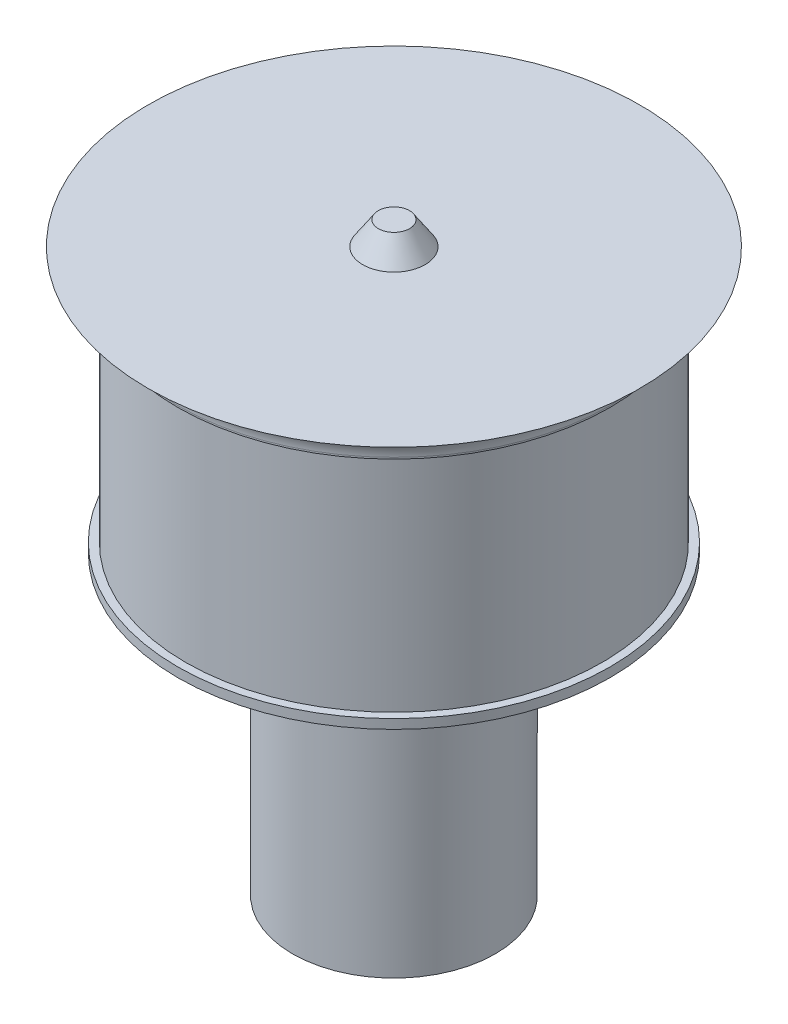
from build123d import *

# Parameters (mm, degrees)
SKETCH_1_R      = 26.7
EXTRUDE_1_DEPTH = 28.8
SKETCH_4_R      = 13
EXTRUDE_2_DEPTH = 39
CHAMFER_1_SIZE  = 1
CHAMFER_1_SIZE2 = 1.5


with BuildPart() as part:
    # 草图1 → 凸台-拉伸1 (new body)
    with BuildSketch(Plane(origin=(0, 0, 0), x_dir=(1, 0, 0), z_dir=(0, 1, 0))):
        Circle(SKETCH_1_R)
    extrude(amount=EXTRUDE_1_DEPTH)

    # 草图2 → 旋转1 (revolve)
    with BuildSketch(Plane.XY):
        Polygon((-27.7, 28.8), (-26.7, 28.8), (0, 28.8), (0, 29), (-27.7, 29), align=None)
    revolve(axis=Axis((0, 37.25413602, 0), (0, -1, 0)))

    # 草图2<3> → 旋转2 (revolve)
    with BuildSketch(Plane.XY):
        with BuildLine():
            ThreePointArc((-31.5, 32.8), (-28.812994231, 31.687005769), (-27.7, 29))
            Line((-27.7, 29), (0, 29))
            Line((0, 29), (0, 32.8))
            Line((0, 32.8), (-31.5, 32.8))
        make_face()
    revolve(axis=Axis((0, 37.25413602, 0), (0, -1, 0)))

    # 草图3 → 旋转3 (revolve)
    with BuildSketch(Plane.XY):
        Polygon((-27.7, 0), (-26.7, 0), (0, 0), (0, -1.2), (-27.7, -1.2), align=None)
    revolve(axis=Axis((0, 9.532579507, 0), (0, -1, 0)))

    # 草图4 → 凸台-拉伸2 (add)
    with BuildSketch(Plane.XZ.offset(1.2)):
        Circle(SKETCH_4_R)
    extrude(amount=EXTRUDE_2_DEPTH)

    # 倒角1
    chamfer_1_edges = [part.edges().sort_by_distance(p)[0] for p in [
        (-13, -40.2, 0),
    ]]
    chamfer_1_side = [part.faces().sort_by_distance(p)[0] for p in [
        (-13, -20.7, 0),
    ]]
    chamfer(chamfer_1_edges, length=CHAMFER_1_SIZE, length2=CHAMFER_1_SIZE2, reference=chamfer_1_side[0])

    # 草图6 → 旋转4 (revolve)
    with BuildSketch(Plane.XY):
        Polygon((-13, -1.2), (-13, -5.2), (-27.7, -1.2), align=None)
    revolve(axis=Axis((0, 5.765222619, 0), (0, -1, 0)))

    # 草图7 → 切除-旋转1 (revolve, cut)
    with BuildSketch(Plane.XY):
        Polygon((-13, -5.2), (-12, -5.2), (-13, -7.2), align=None)
    revolve(axis=Axis((0, -1.925824923, 0), (0, -1, 0)), mode=Mode.SUBTRACT)

    # 草图8 → 旋转5 (revolve)
    with BuildSketch(Plane.XY):
        Polygon((0, 32.8), (0, 35.8), (-2, 35.8), (-4, 32.8), align=None)
    revolve(axis=Axis((0, 18.882882331, 0), (0, 1, 0)))


solid = part.part
